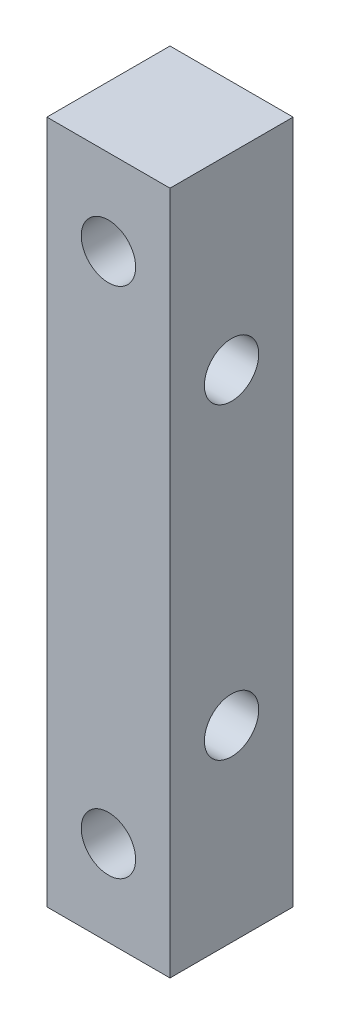
from build123d import *

# Parameters (mm, degrees)
SKETCH1_W                  = 9.144
SKETCH1_H                  = 9.144
BOSS_EXTRUDE1_DEPTH        = 50.8
TAP_DRILL_FOR_10_32_TAP1_D = 4.0386
TAP_DRILL_FOR_10_32_TAP2_D = 4.0386


with BuildPart() as part:
    # Sketch1 → Boss-Extrude1 (new body)
    with BuildSketch(Plane(origin=(0, 0, 0), x_dir=(1, 0, 0), z_dir=(0, 1, 0))):
        Rectangle(SKETCH1_W, SKETCH1_H)
    extrude(amount=BOSS_EXTRUDE1_DEPTH)

    # Tap Drill for #10-32 Tap1 (through all)
    with Locations(Plane.XY.offset(4.572)):
        with Locations((0, 44.45), (0, 6.35)):
            Hole(TAP_DRILL_FOR_10_32_TAP1_D / 2)

    # Tap Drill for #10-32 Tap2 (through all)
    with Locations(Plane(origin=(4.572, 0, 0), x_dir=(0, 0, -1), z_dir=(1, 0, 0))):
        with Locations((0, 36.83), (0, 13.97)):
            Hole(TAP_DRILL_FOR_10_32_TAP2_D / 2)


solid = part.part
